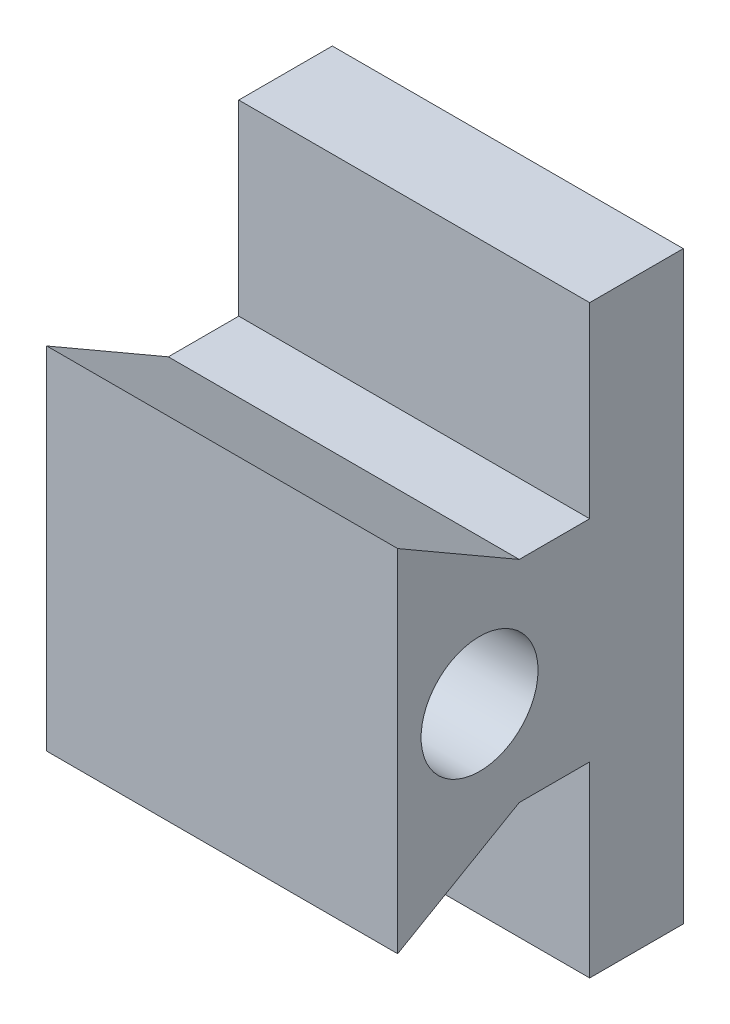
from build123d import *

# Parameters (mm, degrees)
BOSS_EXTRUDE1_DEPTH = 3
SKETCH2_R           = 0.5
CUT_EXTRUDE1_DEPTH  = 5.605420599


with BuildPart() as part:
    # Sketch1 → Boss-Extrude1 (new body)
    with BuildSketch(Plane(origin=(0, 0, 0), x_dir=(0, 0, -1), z_dir=(1, 0, 0))):
        Polygon((0, -1.5), (0, 1.5), (1.039230485, 0.9), (1.641290416, 0.9), (1.641290416, 2.5), (2.441290416, 2.5), (2.441290416, -2.5), (1.641290416, -2.5), (1.641290416, -0.9), (1.039230485, -0.9), align=None)
    extrude(amount=BOSS_EXTRUDE1_DEPTH)

    # Sketch2 → Cut-Extrude1 (cut, through all)
    with BuildSketch(Plane(origin=(3, 0, 0), x_dir=(0, 0, -1), z_dir=(1, 0, 0))):
        with Locations((0.7, 0)):
            Circle(SKETCH2_R)
    extrude(amount=-CUT_EXTRUDE1_DEPTH, mode=Mode.SUBTRACT)


solid = part.part
